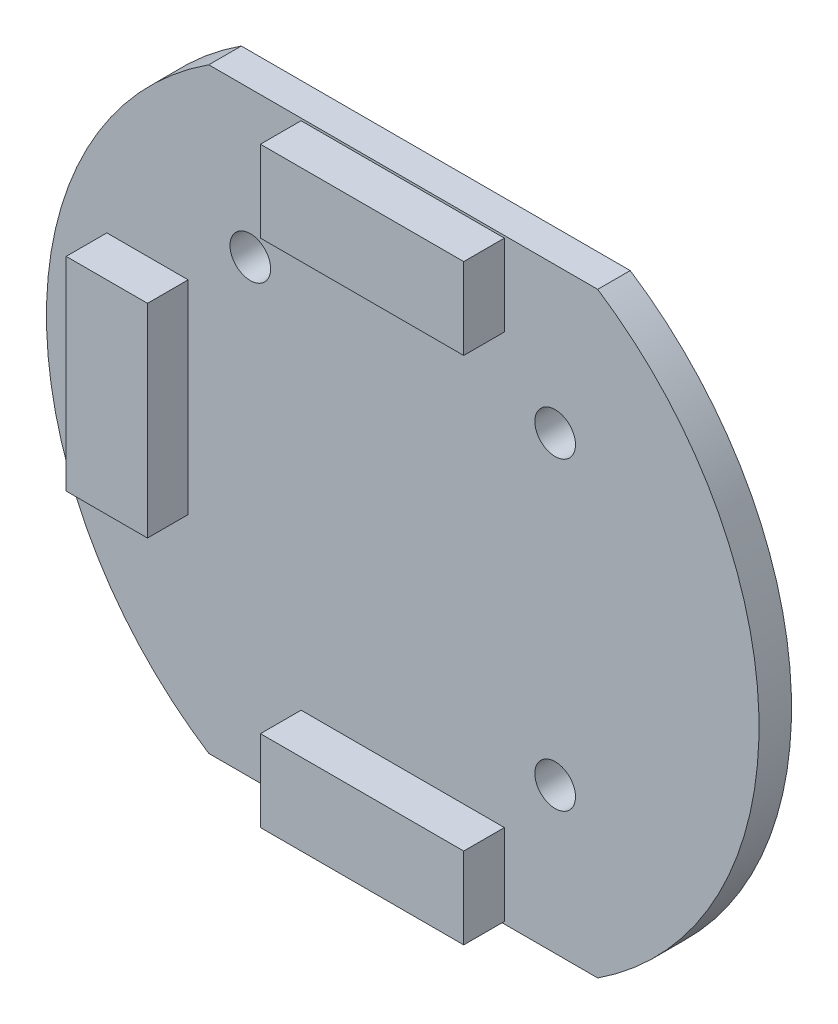
from build123d import *

# Parameters (mm, degrees)
SKETCH_1_R      = 1
EXTRUDE_1_DEPTH = 1.6
SKETCH_2_W      = 1.777379574
SKETCH_2_H      = 3.627987188
EXTRUDE_2_DEPTH = 1.7
SKETCH_3_W      = 4
SKETCH_3_H      = 10
SKETCH_3_W_2    = 10
SKETCH_3_H_2    = 4
EXTRUDE_3_DEPTH = 2


with BuildPart() as part:
    # 草图1 → 凸台-拉伸1 (new body)
    with BuildSketch(Plane.XY):
        with BuildLine():
            Line((-9.541571686, 14.6685), (9.591443257, 14.6685))
            ThreePointArc((9.591443257, 14.6685), (17.526, 0), (9.591443257, -14.6685))
            Line((9.591443257, -14.6685), (-9.541571686, -14.6685))
            ThreePointArc((-9.541571686, -14.6685), (-17.526, 0), (-9.541571686, 14.6685))
        make_face()
        with Locations((7.498513861, -7.498513861)):
            Circle(SKETCH_1_R, mode=Mode.SUBTRACT)
        with Locations((-7.498513861, 7.498513861)):
            Circle(SKETCH_1_R, mode=Mode.SUBTRACT)
        with Locations((7.498513861, 7.498513861)):
            Circle(SKETCH_1_R, mode=Mode.SUBTRACT)
    extrude(amount=EXTRUDE_1_DEPTH)

    # 草图2 → 凸台-拉伸2 (add)
    with BuildSketch(Plane(origin=(0, 0, 0), x_dir=(-1, 0, 0), z_dir=(0, 0, -1))):
        Rectangle(SKETCH_2_W, SKETCH_2_H)
    extrude(amount=EXTRUDE_2_DEPTH)

    # 草图3 → 凸台-拉伸3 (add)
    with BuildSketch(Plane.XY.offset(1.6)):
        with Locations((-12.555549106, 0)):
            Rectangle(SKETCH_3_W, SKETCH_3_H)
        with Locations((0, -12.555549106)):
            Rectangle(SKETCH_3_W_2, SKETCH_3_H_2)
        with Locations((0, 12.555549106)):
            Rectangle(SKETCH_3_W_2, SKETCH_3_H_2)
    extrude(amount=EXTRUDE_3_DEPTH)


solid = part.part
